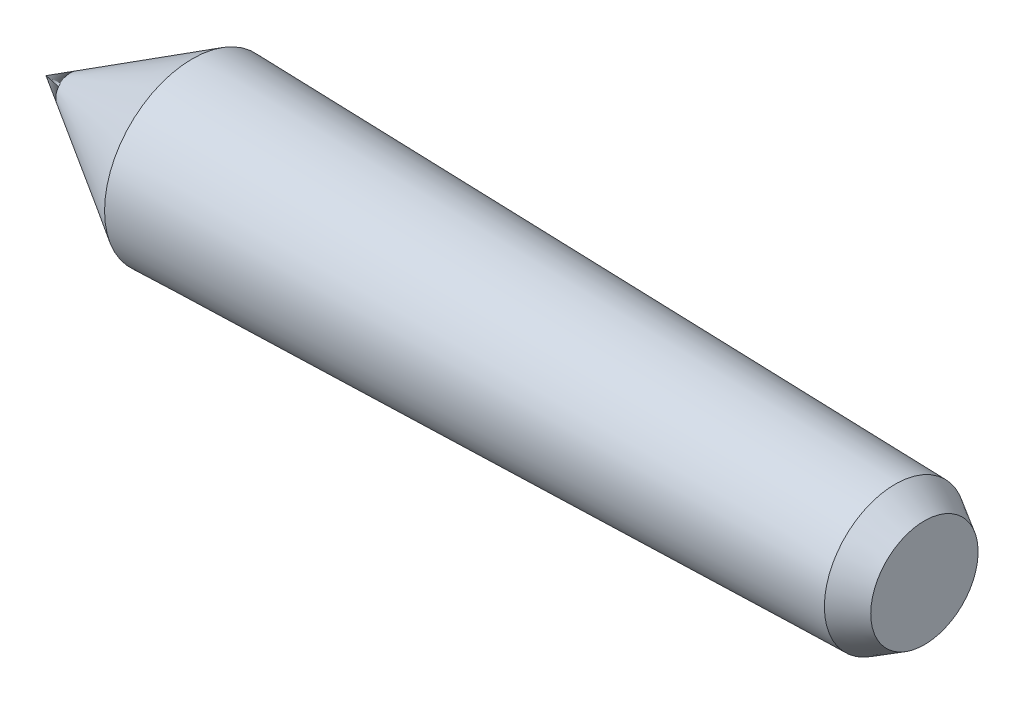
from build123d import *


with BuildPart() as part:
    # Sketch1 → Revolve1 (revolve)
    with BuildSketch(Plane.XY, mode=Mode.PRIVATE) as revolve1_sk:
        Polygon((0, 0), (90, 0), (90, 5.5), (87, 7.25), (15, 9), align=None)
    revolve(revolve1_sk.sketch.rotate(Axis((0, 0, 0), (1, 0, 0)), 90), axis=Axis((0, 0, 0), (1, 0, 0)))


solid = part.part
